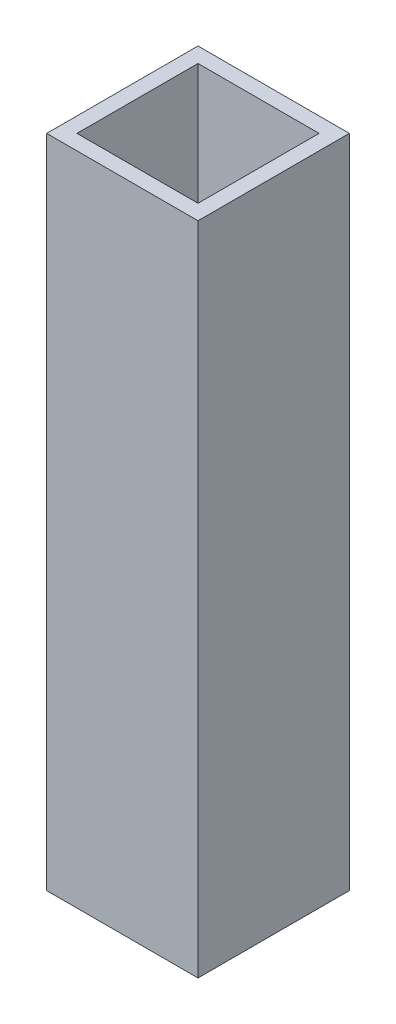
from build123d import *

# Parameters (mm, degrees)
CROQUIS1_W              = 30
CROQUIS1_H              = 30
CROQUIS1_W_2            = 24
CROQUIS1_H_2            = 24
SALIENTE_EXTRUIR1_DEPTH = 130


with BuildPart() as part:
    # Croquis1 → Saliente-Extruir1 (new body)
    with BuildSketch(Plane(origin=(0, 0, 0), x_dir=(1, 0, 0), z_dir=(0, 1, 0))):
        Rectangle(CROQUIS1_W, CROQUIS1_H)
        Rectangle(CROQUIS1_W_2, CROQUIS1_H_2, mode=Mode.SUBTRACT)
    extrude(amount=SALIENTE_EXTRUIR1_DEPTH)


solid = part.part
